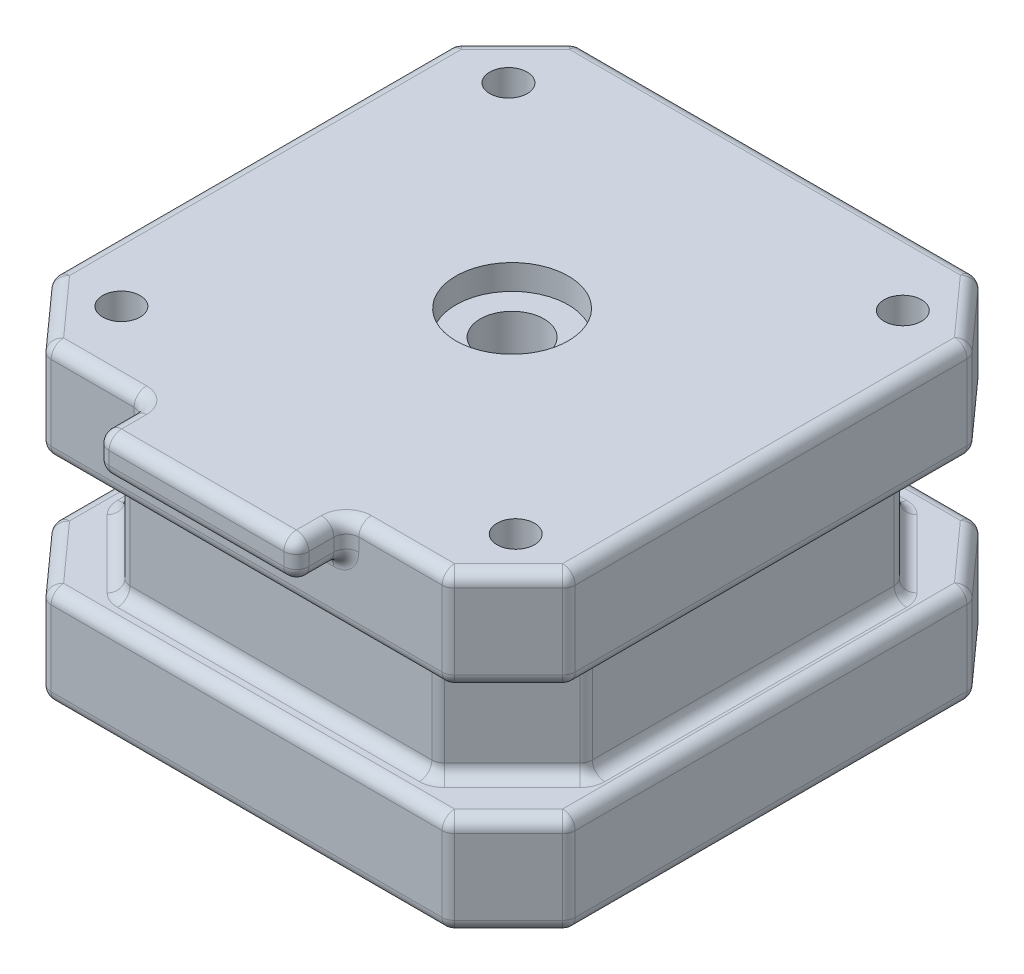
from build123d import *

# Parameters (mm, degrees)
BOSS_EXTRUDE1_DEPTH = 8.02
SKETCH2_R           = 1.5
CUT_EXTRUDE1_DEPTH  = 6
SKETCH3_R           = 11
SKETCH3_R_2         = 4.5
BOSS_EXTRUDE2_DEPTH = 2
BOSS_EXTRUDE3_DEPTH = 9
SKETCH4_R           = 2.55
CUT_EXTRUDE2_DEPTH  = 39.987035572
SKETCH6_R           = 4.5
CUT_EXTRUDE3_DEPTH  = 2
SKETCH8_W           = 16
SKETCH8_H           = 4
BOSS_EXTRUDE5_DEPTH = 3.04
FILLET1_R           = 1


with BuildPart() as part:
    # Sketch1 → Boss-Extrude1 (new body)
    with BuildSketch(Plane(origin=(0, 0, 0), x_dir=(1, 0, 0), z_dir=(0, 1, 0))):
        Polygon((16.085, 21.260594368), (-16.085, 21.260594368), (-20.999392129, 16.346202238), (-20.999392129, -15.823797762), (-16.360887743, -20.999392129), (15.809112257, -20.999392129), (20.723504386, -16.085), (20.723504386, 16.085), align=None)
    boss_extrude1 = extrude(amount=BOSS_EXTRUDE1_DEPTH)

    # Sketch2 → Cut-Extrude1 (cut)
    with BuildSketch(Plane.XZ):
        with Locations(Location((-15.79, 15.5, 0), (0, 0, 270))):
            Circle(SKETCH2_R)
        with Locations(Location((15.79, 15.5, 0), (0, 0, 270))):
            Circle(SKETCH2_R)
        with Locations(Location((-15.79, -15.5, 0), (0, 0, 270))):
            Circle(SKETCH2_R)
        with Locations(Location((15.79, -15.5, 0), (0, 0, 270))):
            Circle(SKETCH2_R)
    cut_extrude1 = extrude(amount=-CUT_EXTRUDE1_DEPTH, mode=Mode.SUBTRACT)

    # Sketch3 → Boss-Extrude2 (add)
    with BuildSketch(Plane.XZ):
        with Locations(Location((0, 0, 0), (0, 0, 90))):
            Circle(SKETCH3_R)
        with Locations(Location((0, 0, 0), (0, 0, 270))):
            Circle(SKETCH3_R_2, mode=Mode.SUBTRACT)
    extrude(amount=BOSS_EXTRUDE2_DEPTH)

    # Sketch5 → Boss-Extrude3 (add)
    with BuildSketch(Plane(origin=(0, 8.02, 0), x_dir=(1, 0, 0), z_dir=(0, 1, 0))):
        Polygon((-18.51040764, 12.5), (-12.5, 18.51040764), (12.5, 18.51040764), (18.51040764, 12.5), (18.51040764, -12.5), (12.5, -18.51040764), (-12.5, -18.51040764), (-18.51040764, -12.5), align=None)
    extrude(amount=BOSS_EXTRUDE3_DEPTH)

    # Mirror1: Boss-Extrude1, Cut-Extrude1 across plane
    add(boss_extrude1.mirror(Plane(origin=(0, 12.52, 0), x_dir=(0, 0, 1), z_dir=(0, -1, 0))))
    add(cut_extrude1.mirror(Plane(origin=(0, 12.52, 0), x_dir=(0, 0, 1), z_dir=(0, -1, 0))), mode=Mode.SUBTRACT)

    # Sketch4 → Cut-Extrude2 (cut, through all)
    with BuildSketch(Plane.XZ):
        with Locations(Location((0, 0, 0), (0, 0, 270))):
            Circle(SKETCH4_R)
    extrude(amount=-CUT_EXTRUDE2_DEPTH, mode=Mode.SUBTRACT)

    # Sketch6 → Cut-Extrude3 (cut)
    with BuildSketch(Plane(origin=(0, 25.04, 0), x_dir=(1, 0, 0), z_dir=(0, 1, 0))):
        with Locations(Location((0, 0, 0), (0, 0, 90))):
            Circle(SKETCH6_R)
    extrude(amount=-CUT_EXTRUDE3_DEPTH, mode=Mode.SUBTRACT)

    # Sketch8 → Boss-Extrude5 (add)
    with BuildSketch(Plane(origin=(0, 25.04, 0), x_dir=(1, 0, 0), z_dir=(0, 1, 0))):
        with Locations((-0.275887743, -22.999392129)):
            Rectangle(SKETCH8_W, SKETCH8_H)
    extrude(amount=-BOSS_EXTRUDE5_DEPTH)

    # Fillet1
    fillet1_edges = [part.edges().sort_by_distance(p)[0] for p in [
        (-20.999392129, 0, -0.261202238),
        (-18.542196065, 0, -18.803398303),
        (0, 0, -21.260594368),
        (18.404252193, 0, -18.672797184),
        (11.766612257, 25.04, 20.999392129),
        (7.724112257, 25.04, 22.999392129),
        (7.724112257, 23.52, 20.999392129),
        (-0.275887743, 22, 24.999392129),
        (7.724112257, 23.52, 24.999392129),
        (-8.275887743, 22, 22.999392129),
        (-8.275887743, 23.52, 24.999392129),
        (-8.275887743, 23.52, 20.999392129),
        (7.724112257, 22, 22.999392129),
        (-0.275887743, 22, 20.999392129),
        (-8.275887743, 25.04, 22.999392129),
        (-0.275887743, 25.04, 24.999392129),
        (-18.542196065, 8.02, -18.803398303),
        (20.723504386, 4.01, -16.085),
        (20.723504386, 4.01, 16.085),
        (15.809112257, 4.01, 20.999392129),
        (-16.360887743, 4.01, 20.999392129),
        (-20.999392129, 4.01, 15.823797762),
        (-20.999392129, 4.01, -16.346202238),
        (-16.085, 4.01, -21.260594368),
        (16.085, 4.01, -21.260594368),
        (-20.999392129, 8.02, -0.261202238),
        (-18.680139936, 8.02, 18.411594945),
        (-0.275887743, 8.02, 20.999392129),
        (18.266308322, 8.02, 18.542196065),
        (20.723504386, 8.02, 0),
        (18.404252193, 8.02, -18.672797184),
        (-18.51040764, 8.02, 0),
        (-18.51040764, 12.52, -12.5),
        (-15.50520382, 8.02, 15.50520382),
        (-18.51040764, 12.52, 12.5),
        (0, 8.02, 18.51040764),
        (-12.5, 12.52, 18.51040764),
        (15.50520382, 8.02, 15.50520382),
        (12.5, 12.52, 18.51040764),
        (18.51040764, 8.02, 0),
        (18.51040764, 12.52, 12.5),
        (15.50520382, 8.02, -15.50520382),
        (18.51040764, 12.52, -12.5),
        (0, 8.02, -18.51040764),
        (12.5, 12.52, -18.51040764),
        (-15.50520382, 8.02, -15.50520382),
        (-12.5, 12.52, -18.51040764),
        (-18.51040764, 17.02, 0),
        (-15.50520382, 17.02, 15.50520382),
        (0, 17.02, 18.51040764),
        (15.50520382, 17.02, 15.50520382),
        (18.51040764, 17.02, 0),
        (15.50520382, 17.02, -15.50520382),
        (0, 17.02, -18.51040764),
        (-15.50520382, 17.02, -15.50520382),
        (18.404252193, 17.02, -18.672797184),
        (16.085, 21.03, -21.260594368),
        (20.723504386, 17.02, 0),
        (20.723504386, 21.03, -16.085),
        (18.266308322, 17.02, 18.542196065),
        (20.723504386, 21.03, 16.085),
        (-0.275887743, 17.02, 20.999392129),
        (15.809112257, 21.03, 20.999392129),
        (-18.680139936, 17.02, 18.411594945),
        (-16.360887743, 21.03, 20.999392129),
        (-20.999392129, 17.02, -0.261202238),
        (-20.999392129, 21.03, 15.823797762),
        (-18.542196065, 17.02, -18.803398303),
        (-20.999392129, 21.03, -16.346202238),
        (0, 17.02, -21.260594368),
        (-16.085, 21.03, -21.260594368),
        (18.404252193, 25.04, -18.672797184),
        (0, 25.04, -21.260594368),
        (-18.542196065, 25.04, -18.803398303),
        (-20.999392129, 25.04, -0.261202238),
        (-18.680139936, 25.04, 18.411594945),
        (-12.318387743, 25.04, 20.999392129),
        (18.266308322, 25.04, 18.542196065),
        (20.723504386, 25.04, 0),
        (20.723504386, 0, 0),
        (0, 8.02, -21.260594368),
        (18.266308322, 0, 18.542196065),
        (-0.275887743, 0, 20.999392129),
        (-18.680139936, 0, 18.411594945),
    ]]
    fillet(fillet1_edges, radius=FILLET1_R)


solid = part.part
